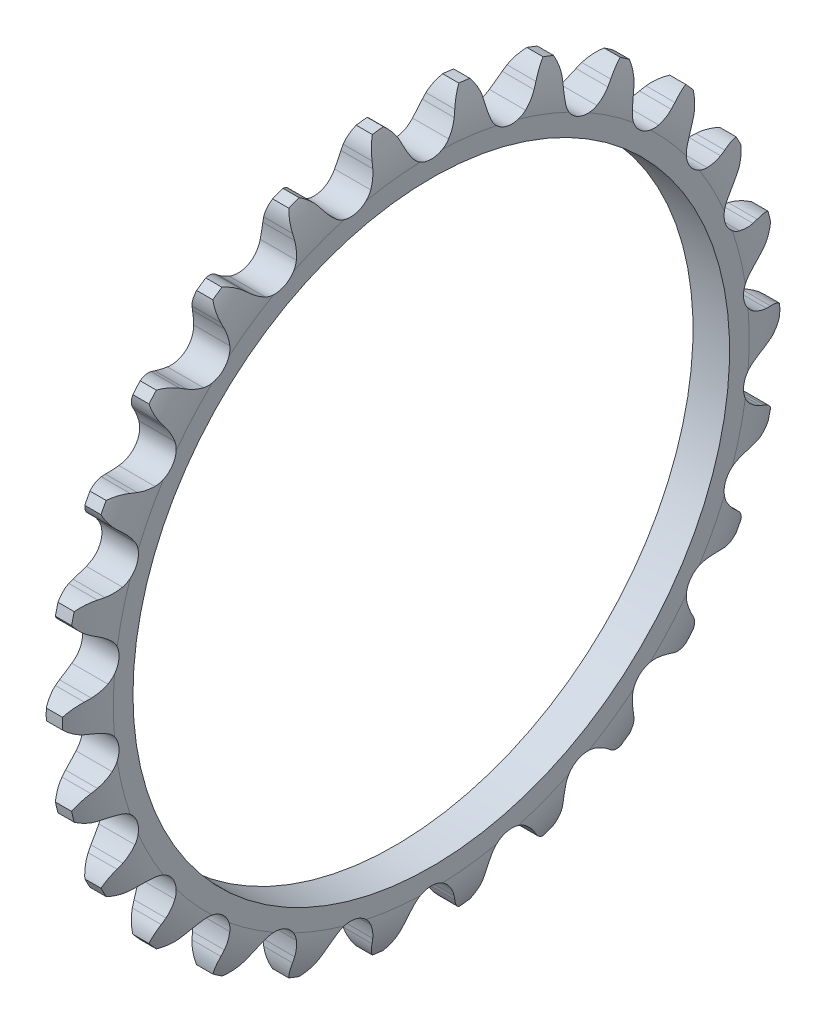
from build123d import *

# Parameters (mm, degrees)
TOOTHCUT_DEPTH     = 60.664736282
TEETHCUTS_COUNT    = 26
TEETHCUTS_ANGLE    = 346.153846154
BORSKE_R           = 7.9375
BORE_DEPTH         = 50.8000508
SKETCH2_R          = 35
CUT_EXTRUDE1_DEPTH = 60.500295595


with BuildPart() as part:
    # BasProSke → Base-Revolve (revolve)
    with BuildSketch(Plane(origin=(0, 0, 0), x_dir=(1, 0, 0), z_dir=(0, 1, 0)), mode=Mode.PRIVATE) as base_revolve_sk:
        with BuildLine():
            Line((0, 0), (0, 37.305016341))
            ThreePointArc((0, 37.305016341), (0.302973008, 39.766098089), (1.1938, 42.080216341))
            Line((1.1938, 42.080216341), (3.094736, 42.080216341))
            ThreePointArc((3.094736, 42.080216341), (3.985562992, 39.766098089), (4.288536, 37.305016341))
            Line((4.288536, 37.305016341), (4.288536, 0))
            Line((4.288536, 0), (0, 0))
        make_face()
    revolve(base_revolve_sk.sketch.rotate(Axis((-10, 0, 0), (1, 0, 0)), 180), axis=Axis((-10, 0, 0), (1, 0, 0)))

    # TooCutSke → ToothCut (cut, through all)
    with BuildSketch(Plane(origin=(0, 0, 0), x_dir=(0, 0, -1), z_dir=(1, 0, 0))):
        with BuildLine():
            Line((2.960905125, 39.53912996), (3.208101468, 40.16791191))
            ThreePointArc((3.208101468, 40.16791191), (4.729530615, 42.074035701), (7.060145513, 42.792568058))
            ThreePointArc((7.060145513, 42.792568058), (0, 43.371067956), (-7.060145513, 42.792568058))
            ThreePointArc((-7.060145513, 42.792568058), (-4.729530615, 42.074035701), (-3.208101468, 40.16791191))
            Line((-3.208101468, 40.16791191), (-2.960905125, 39.53912996))
            ThreePointArc((-2.960905125, 39.53912996), (-2.566157095, 38.708655964), (-2.060701894, 37.940523094))
            ThreePointArc((-2.060701894, 37.940523094), (0, 36.919994518), (2.060701894, 37.940523094))
            ThreePointArc((2.060701894, 37.940523094), (2.566157095, 38.708655964), (2.960905125, 39.53912996))
        make_face()
    toothcut = extrude(amount=TOOTHCUT_DEPTH, mode=Mode.SUBTRACT)

    # TeethCuts: ToothCut ×26 about axis
    teethcuts_axis = Axis((-10, 0, 0), (1, 0, 0))
    for i in range(1, TEETHCUTS_COUNT):
        add(toothcut.rotate(teethcuts_axis, i * TEETHCUTS_ANGLE / (TEETHCUTS_COUNT - 1)), mode=Mode.SUBTRACT)

    # BorSke → Bore (cut, symmetric)
    with BuildSketch(Plane(origin=(0, 0, 0), x_dir=(0, 0, -1), z_dir=(1, 0, 0))):
        with Locations(Location((0, 0, 0), (0, 0, 180))):
            Circle(BORSKE_R)
    extrude(amount=BORE_DEPTH, both=True, mode=Mode.SUBTRACT)

    # Sketch2 → Cut-Extrude1 (cut, through all)
    with BuildSketch(Plane.ZY):
        Circle(SKETCH2_R)
    extrude(amount=-CUT_EXTRUDE1_DEPTH, mode=Mode.SUBTRACT)


solid = part.part
